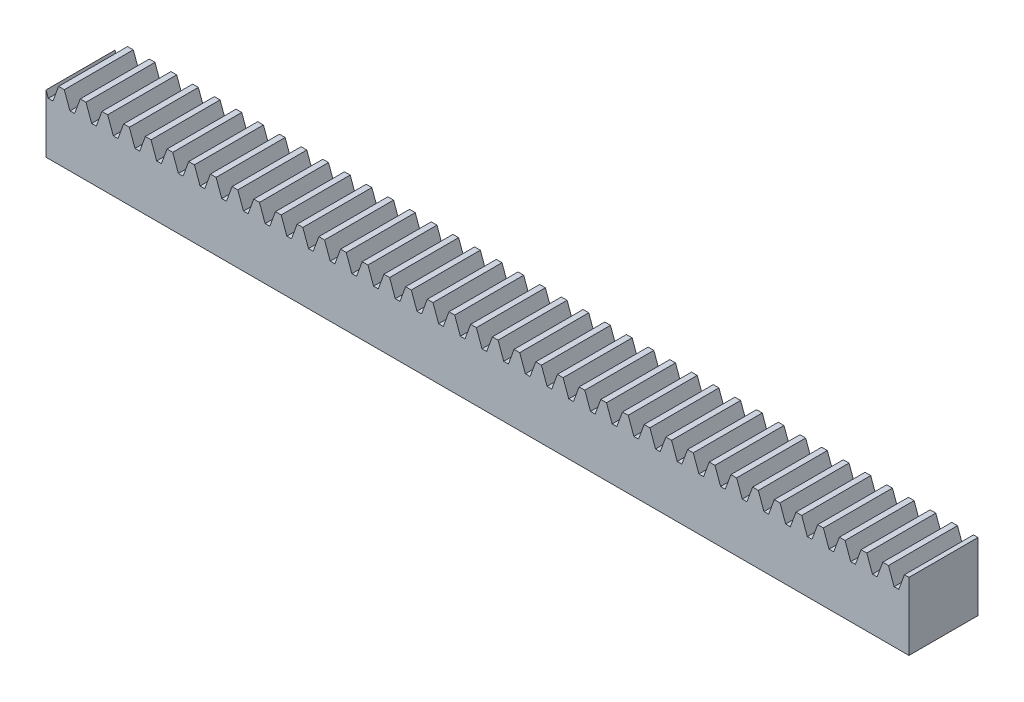
from build123d import *

# Parameters (mm, degrees)
RITNING_1_W          = 250
RITNING_1_H          = 9.8
KUGGST_NGS_MNE_DEPTH = 10
KUGGLUCKA_DEPTH      = 10
LPATTERN_COUNT       = 80
LPATTERN_PITCH       = 3.14159265
SKETCH1_W            = 169.434667142
SKETCH1_H            = 26.090987892
CUT_EXTRUDE1_DEPTH   = 10


with BuildPart() as part:
    # Ritning 1 → Kuggstångsämne (new body)
    with BuildSketch(Plane.XY):
        with Locations((0.9, 0)):
            Rectangle(RITNING_1_W, RITNING_1_H)
    extrude(amount=KUGGST_NGS_MNE_DEPTH)

    # Ritning 2 → Kugglucka (cut)
    with BuildSketch(Plane.XY.offset(10)):
        with BuildLine():
            Line((-124.438289352, 2.65), (-123.761710648, 2.65))
            Line((-123.761710648, 2.65), (-122.942777621, 4.9))
            Line((-122.942777621, 4.9), (-124.1, 6.057222379))
            Line((-124.1, 6.057222379), (-125.257222379, 4.9))
            add(Edge.make_bspline(
                [(-125.257222379, 4.9), (-124.984244704, 4.15), (-124.711267028, 3.4), (-124.438289352, 2.65)],
                knots=[0, 0, 0, 0, 1, 1, 1, 1], degree=3))
        make_face()
    kugglucka = extrude(amount=-KUGGLUCKA_DEPTH, mode=Mode.SUBTRACT)

    # LPattern: Kugglucka ×80
    with Locations(*[(i * LPATTERN_PITCH, 0, 0) for i in range(1, LPATTERN_COUNT)]):
        add(kugglucka, mode=Mode.SUBTRACT)

    # Sketch1 → Cut-Extrude1 (cut)
    with BuildSketch(Plane(origin=(0, 0, 0), x_dir=(-1, 0, 0), z_dir=(0, 0, -1))):
        with Locations((83.817333571, 8.145493946)):
            Rectangle(SKETCH1_W, SKETCH1_H)
    extrude(amount=-CUT_EXTRUDE1_DEPTH, mode=Mode.SUBTRACT)


solid = part.part
